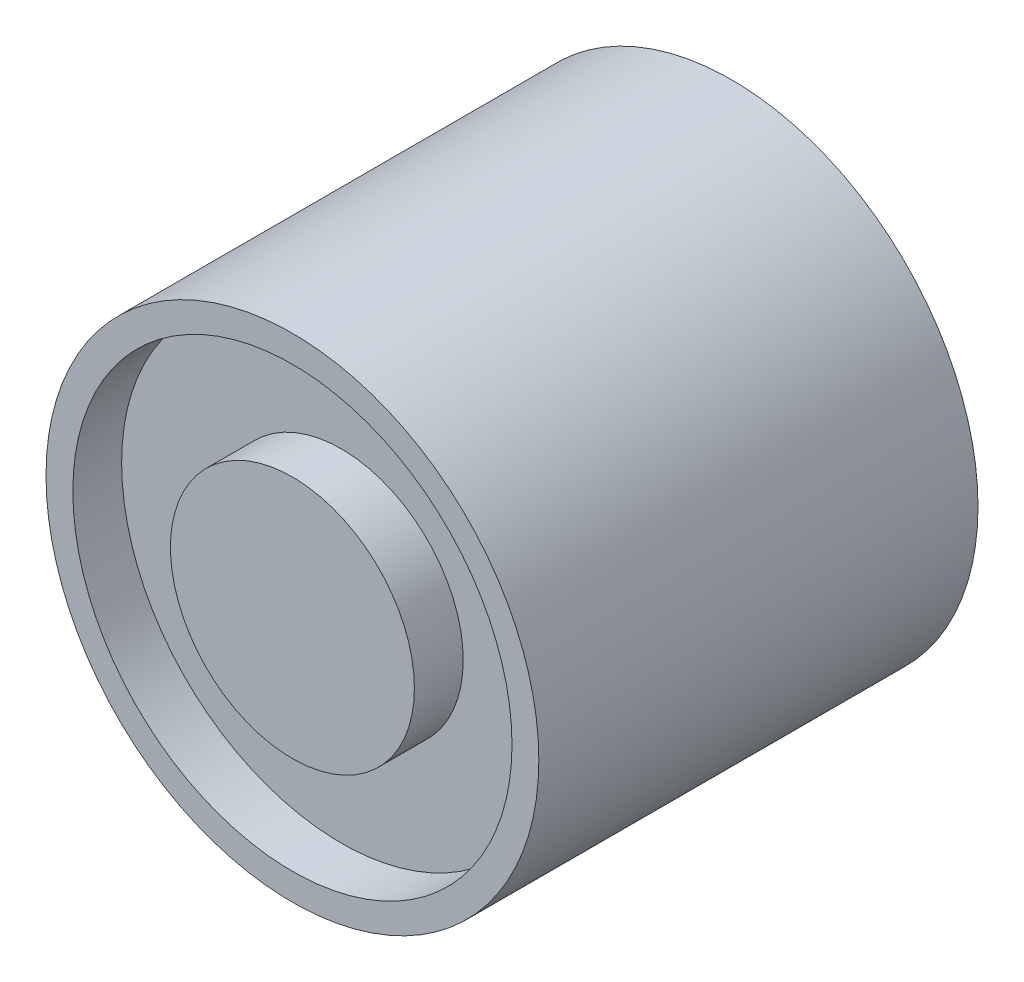
from build123d import *

# Parameters (mm, degrees)
SKETCH1_R           = 12.827
BOSS_EXTRUDE1_DEPTH = 20.32
SKETCH2_R           = 12.827
SKETCH2_R_2         = 11.43
SKETCH2_R_3         = 6.35
BOSS_EXTRUDE2_DEPTH = 2.54


with BuildPart() as part:
    # Sketch1 → Boss-Extrude1 (new body)
    with BuildSketch(Plane.XY):
        Circle(SKETCH1_R)
    extrude(amount=BOSS_EXTRUDE1_DEPTH)

    # Sketch2 → Boss-Extrude2 (add)
    # profile 1 of 2: a face of its own
    with BuildSketch(Plane.XY.offset(20.32)):
        Circle(SKETCH2_R)
        Circle(SKETCH2_R_2, mode=Mode.SUBTRACT)
    # profile 2 of 2: a face of its own
    with BuildSketch(Plane.XY.offset(20.32)):
        Circle(SKETCH2_R_3)
    extrude(amount=BOSS_EXTRUDE2_DEPTH)


solid = part.part
